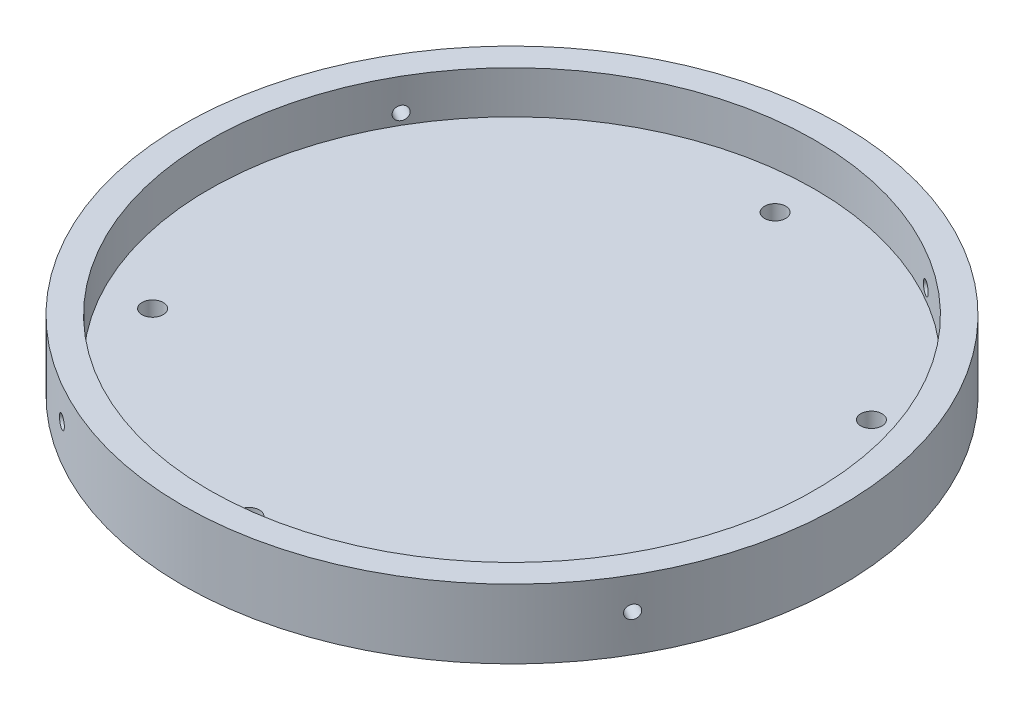
from build123d import *

# Parameters (mm, degrees)
SKETCH1_R               = 62
BOSS_EXTRUDE1_DEPTH     = 5
SKETCH2_R               = 2
CUT_EXTRUDE1_DEPTH      = 5
CIRPATTERN1_COUNT       = 2
CIRPATTERN1_ANGLE       = 120
MIRROR1_COPY_1_SKETCH_R = 2
MIRROR1_COPY_1_DEPTH    = 5
SKETCH5_R               = 62
SKETCH5_R_2             = 57
BOSS_EXTRUDE2_DEPTH     = 8
CUT_EXTRUDE2_START      = -90
SKETCH6_R               = 1.25
CUT_EXTRUDE2_DEPTH      = 192
CIRPATTERN2_COUNT       = 2
CIRPATTERN2_ANGLE       = 90


with BuildPart() as part:
    # Sketch1 → Boss-Extrude1 (new body)
    with BuildSketch(Plane(origin=(0, 0, 0), x_dir=(1, 0, 0), z_dir=(0, 1, 0))):
        with Locations(Location((0, 0, 0), (0, 0, 270))):
            Circle(SKETCH1_R)
    extrude(amount=BOSS_EXTRUDE1_DEPTH)

    # Sketch2 → Cut-Extrude1 (cut)
    with BuildSketch(Plane(origin=(0, 5, 0), x_dir=(1, 0, 0), z_dir=(0, 1, 0))):
        with Locations(Location((0, 49.5, 0), (0, 0, 270))):
            Circle(SKETCH2_R)
    cut_extrude1 = extrude(amount=-CUT_EXTRUDE1_DEPTH, mode=Mode.SUBTRACT)

    # CirPattern1: Cut-Extrude1 ×2 about axis
    cirpattern1_axis = Axis((0, 5, 0), (0, 1, 0))
    for i in range(1, CIRPATTERN1_COUNT):
        add(cut_extrude1.rotate(cirpattern1_axis, i * CIRPATTERN1_ANGLE / (CIRPATTERN1_COUNT - 1)), mode=Mode.SUBTRACT)

    # Mirror1: Cut-Extrude1 across plane
    add(cut_extrude1.mirror(Plane(origin=(0, 0, 0), x_dir=(-0.49999999999999806, 0, 0.8660254037844398), z_dir=(-0.8660254037844398, 0, -0.49999999999999806))), mode=Mode.SUBTRACT)

    # Mirror1 copy 1 sketch → Mirror1 copy 1 (cut)
    with BuildSketch(Plane(origin=(0, 5, 0), x_dir=(1, 0, 0), z_dir=(0, 1, 0))):
        with Locations((0, -49.5)):
            Circle(MIRROR1_COPY_1_SKETCH_R)
    extrude(amount=-MIRROR1_COPY_1_DEPTH, mode=Mode.SUBTRACT)

    # Sketch5 → Boss-Extrude2 (add)
    with BuildSketch(Plane(origin=(0, 5, 0), x_dir=(1, 0, 0), z_dir=(0, 1, 0))):
        with Locations(Location((0, 0, 0), (0, 0, 270))):
            Circle(SKETCH5_R)
        with Locations(Location((0, 0, 0), (0, 0, 270))):
            Circle(SKETCH5_R_2, mode=Mode.SUBTRACT)
    extrude(amount=BOSS_EXTRUDE2_DEPTH)

    # Sketch6 → Cut-Extrude2 (cut)
    with BuildSketch(Plane(origin=(0, 0, 0), x_dir=(-0.49999999999999806, 0, 0.8660254037844398), z_dir=(-0.8660254037844398, 0, -0.49999999999999806)).offset(CUT_EXTRUDE2_START)):
        with Locations(Location((0, 7, 0), (0, 0, 180))):
            Circle(SKETCH6_R)
    cut_extrude2 = extrude(amount=CUT_EXTRUDE2_DEPTH, mode=Mode.SUBTRACT)

    # CirPattern2: Cut-Extrude2 ×2 about axis
    cirpattern2_axis = Axis((0, 13, 0), (0, 1, 0))
    for i in range(1, CIRPATTERN2_COUNT):
        add(cut_extrude2.rotate(cirpattern2_axis, i * CIRPATTERN2_ANGLE / (CIRPATTERN2_COUNT - 1)), mode=Mode.SUBTRACT)


solid = part.part
